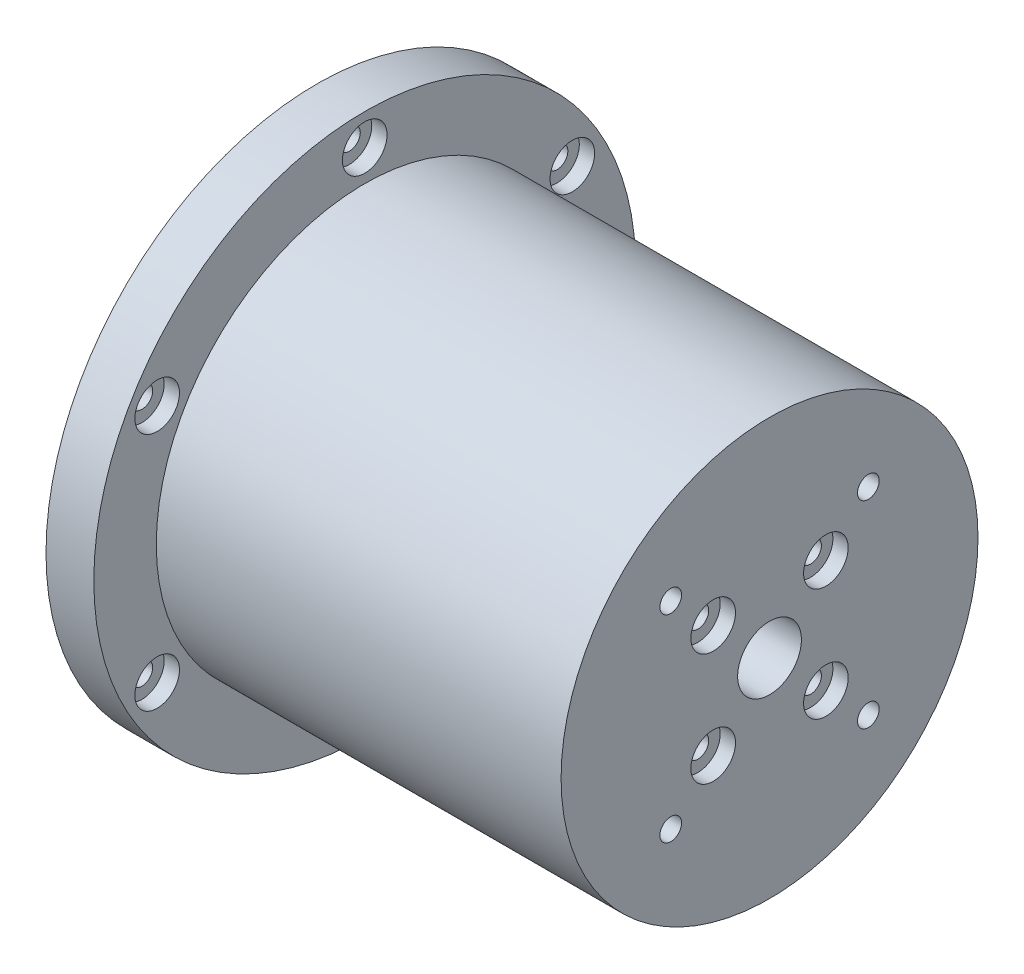
from build123d import *

# Parameters (mm, degrees)
CROQUIS1_R                                           = 32.7
CROQUIS1_R_2                                         = 5
SALIENTE_EXTRUIR1_DEPTH                              = 4.25
REFRENTADO_PARA_TORNILLO_CON_CABEZA_TRON_D           = 3.4
REFRENTADO_PARA_TORNILLO_CON_CABEZA_TRON_CBORE_D     = 7
REFRENTADO_PARA_TORNILLO_CON_CABEZA_TRON_CBORE_DEPTH = 2.4
CROQUIS5_R                                           = 32.7
CROQUIS5_R_2                                         = 21.5
SALIENTE_EXTRUIR2_DEPTH                              = 55
TALADRO_DE_MARGEN_PARA_M31_D                         = 3.4
TALADRO_DE_MARGEN_PARA_M31_DEPTH                     = 15
TALADRO_DE_MARGEN_PARA_M31_TIP                       = 1.021463052
TALADRO_DE_MARGEN_PARA_M32_D                         = 3.4
TALADRO_DE_MARGEN_PARA_M32_DEPTH                     = 16.5
TALADRO_DE_MARGEN_PARA_M32_TIP                       = 1.021463052
CROQUIS16_R                                          = 42.5
SALIENTE_EXTRUIR3_DEPTH                              = 7.5
REFRENTADO_PARA_TORNILLO_CON_CABEZA_2_D              = 3.4
REFRENTADO_PARA_TORNILLO_CON_CABEZA_2_CBORE_D        = 7
REFRENTADO_PARA_TORNILLO_CON_CABEZA_2_CBORE_DEPTH    = 2.4


with BuildPart() as part:
    # Croquis1 → Saliente-Extruir1 (new, symmetric)
    with BuildSketch(Plane(origin=(0, 0, 0), x_dir=(0, 0, -1), z_dir=(1, 0, 0))):
        Circle(CROQUIS1_R)
        Circle(CROQUIS1_R_2, mode=Mode.SUBTRACT)
    extrude(amount=SALIENTE_EXTRUIR1_DEPTH, both=True)

    # Refrentado para tornillo con cabeza tron (through all)
    with Locations(Plane(origin=(4.25, 0, 0), x_dir=(0, 0, -1), z_dir=(1, 0, 0))):
        with Locations((8.838834765, 8.838834765), (-8.838834765, -8.838834765), (-8.838834765, 8.838834765), (8.838834765, -8.838834765)):
            CounterBoreHole(REFRENTADO_PARA_TORNILLO_CON_CABEZA_TRON_D / 2, REFRENTADO_PARA_TORNILLO_CON_CABEZA_TRON_CBORE_D / 2, REFRENTADO_PARA_TORNILLO_CON_CABEZA_TRON_CBORE_DEPTH)

    # Croquis5 → Saliente-Extruir2 (add)
    with BuildSketch(Plane.ZY.offset(4.25)):
        Circle(CROQUIS5_R)
        Circle(CROQUIS5_R_2, mode=Mode.SUBTRACT)
    extrude(amount=SALIENTE_EXTRUIR2_DEPTH)

    # Taladro de margen para M31
    with Locations(Plane.ZY.offset(59.25)):
        with Locations((17.075, 17.075), (-17.075, -17.075), (-17.075, 17.075), (17.075, -17.075)):
            Hole(TALADRO_DE_MARGEN_PARA_M31_D / 2, depth=TALADRO_DE_MARGEN_PARA_M31_DEPTH)
            with Locations((0, 0, -(TALADRO_DE_MARGEN_PARA_M31_DEPTH + TALADRO_DE_MARGEN_PARA_M31_TIP / 2))):  # 118° drill point
                Cone(0, TALADRO_DE_MARGEN_PARA_M31_D / 2, TALADRO_DE_MARGEN_PARA_M31_TIP, mode=Mode.SUBTRACT)

    # Taladro de margen para M32
    with Locations(Plane(origin=(4.25, 0, 0), x_dir=(0, 0, -1), z_dir=(1, 0, 0))):
        with Locations((15.5, 15.5), (-15.5, -15.5), (-15.5, 15.5), (15.5, -15.5)):
            Hole(TALADRO_DE_MARGEN_PARA_M32_D / 2, depth=TALADRO_DE_MARGEN_PARA_M32_DEPTH)
            with Locations((0, 0, -(TALADRO_DE_MARGEN_PARA_M32_DEPTH + TALADRO_DE_MARGEN_PARA_M32_TIP / 2))):  # 118° drill point
                Cone(0, TALADRO_DE_MARGEN_PARA_M32_D / 2, TALADRO_DE_MARGEN_PARA_M32_TIP, mode=Mode.SUBTRACT)

    # Croquis16 → Saliente-Extruir3 (add)
    with BuildSketch(Plane.ZY.offset(59.25)):
        Circle(CROQUIS16_R)
        with BuildLine():
            Line((-18.5, -21.5), (18.5, -21.5))
            ThreePointArc((18.5, -21.5), (20.621320344, -20.621320344), (21.5, -18.5))
            Line((21.5, -18.5), (21.5, 18.5))
            ThreePointArc((21.5, 18.5), (20.621320344, 20.621320344), (18.5, 21.5))
            Line((18.5, 21.5), (-18.5, 21.5))
            ThreePointArc((-18.5, 21.5), (-20.621320344, 20.621320344), (-21.5, 18.5))
            Line((-21.5, 18.5), (-21.5, -18.5))
            ThreePointArc((-21.5, -18.5), (-20.621320344, -20.621320344), (-18.5, -21.5))
        make_face(mode=Mode.SUBTRACT)
    extrude(amount=SALIENTE_EXTRUIR3_DEPTH)

    # Refrentado para tornillo con cabeza  2 (through all)
    with Locations(Plane(origin=(-59.25, 0, 0), x_dir=(0, 0, -1), z_dir=(1, 0, 0))):
        with Locations((-32.562555182, 18.8), (0, 37.6), (32.562555182, 18.8), (32.562555182, -18.8), (0, -37.6), (-32.562555182, -18.8)):
            CounterBoreHole(REFRENTADO_PARA_TORNILLO_CON_CABEZA_2_D / 2, REFRENTADO_PARA_TORNILLO_CON_CABEZA_2_CBORE_D / 2, REFRENTADO_PARA_TORNILLO_CON_CABEZA_2_CBORE_DEPTH)


solid = part.part
